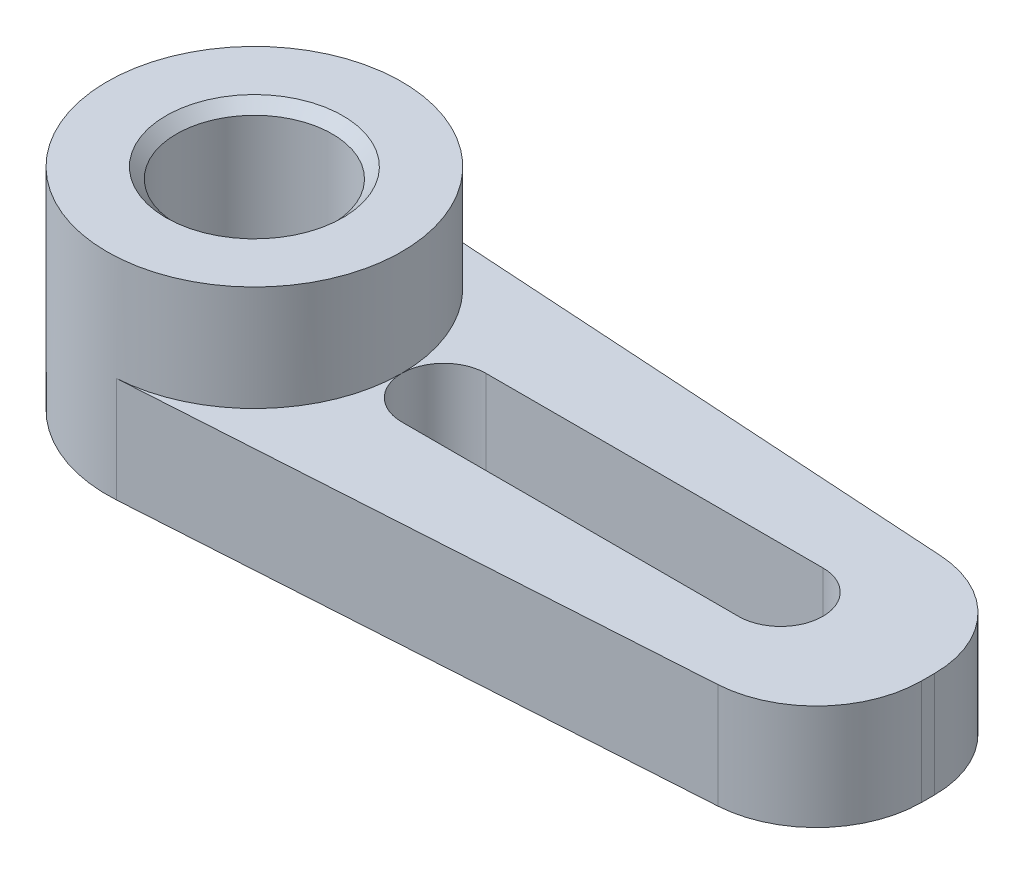
from build123d import *

# Parameters (mm, degrees)
SKETCH1_R           = 1.25
BOSS_EXTRUDE1_DEPTH = 2.5
SKETCH2_R           = 3.5
SKETCH2_R_2         = 1.25
BOSS_EXTRUDE2_DEPTH = 2.5
CUT_EXTRUDE1_START  = -3
SKETCH3_R           = 1.85
SKETCH3_R_2         = 1.25
CUT_EXTRUDE1_DEPTH  = 3
CHAMFER1_SIZE       = 0.25
CUT_EXTRUDE2_DEPTH  = 3
FILLET1_R           = 2.5


with BuildPart() as part:
    # Sketch1 → Boss-Extrude1 (new body)
    with BuildSketch(Plane(origin=(0, 0, 0), x_dir=(1, 0, 0), z_dir=(0, 1, 0))):
        with BuildLine():
            ThreePointArc((0.219829752, 3.49308959), (-3.5, 0), (0.219829752, -3.49308959))
            Line((0.219829752, -3.49308959), (16, -2.5))
            Line((16, -2.5), (16, 2.5))
            Line((16, 2.5), (0.219829752, 3.49308959))
        make_face()
        with Locations(Location((0, 0, 0), (0, 0, 270))):
            Circle(SKETCH1_R, mode=Mode.SUBTRACT)
    extrude(amount=BOSS_EXTRUDE1_DEPTH)

    # Sketch2 → Boss-Extrude2 (add)
    with BuildSketch(Plane(origin=(0, 2.5, 0), x_dir=(1, 0, 0), z_dir=(0, 1, 0))):
        with Locations(Location((0, 0, 0), (0, 0, 86.398967731))):
            Circle(SKETCH2_R)
        with Locations(Location((0, 0, 0), (0, 0, 270))):
            Circle(SKETCH2_R_2, mode=Mode.SUBTRACT)
    extrude(amount=BOSS_EXTRUDE2_DEPTH)

    # Sketch3 → Cut-Extrude1 (cut)
    with BuildSketch(Plane(origin=(0, 5, 0), x_dir=(1, 0, 0), z_dir=(0, 1, 0)).offset(CUT_EXTRUDE1_START)):
        with Locations(Location((0, 0, 0), (0, 0, 270))):
            Circle(SKETCH3_R)
        with Locations(Location((0, 0, 0), (0, 0, 270))):
            Circle(SKETCH3_R_2, mode=Mode.SUBTRACT)
    extrude(amount=CUT_EXTRUDE1_DEPTH, mode=Mode.SUBTRACT)

    # Chamfer1
    chamfer1_edges = [part.edges().sort_by_distance(p)[0] for p in [
        (0, 5, -1.85),
    ]]
    chamfer(chamfer1_edges, length=CHAMFER1_SIZE)

    # Sketch4 → Cut-Extrude2 (cut)
    with BuildSketch(Plane(origin=(0, 2.5, 0), x_dir=(1, 0, 0), z_dir=(0, 1, 0))):
        with BuildLine():
            Line((4.5, 1), (12.5, 1))
            ThreePointArc((12.5, 1), (13.5, 0), (12.5, -1))
            Line((12.5, -1), (4.5, -1))
            ThreePointArc((4.5, -1), (3.5, 0), (4.5, 1))
        make_face()
    extrude(amount=-CUT_EXTRUDE2_DEPTH, mode=Mode.SUBTRACT)

    # Fillet1
    fillet1_edges = [part.edges().sort_by_distance(p)[0] for p in [
        (16, 1.25, -2.5),
        (16, 1.25, 2.5),
    ]]
    fillet(fillet1_edges, radius=FILLET1_R)


solid = part.part
